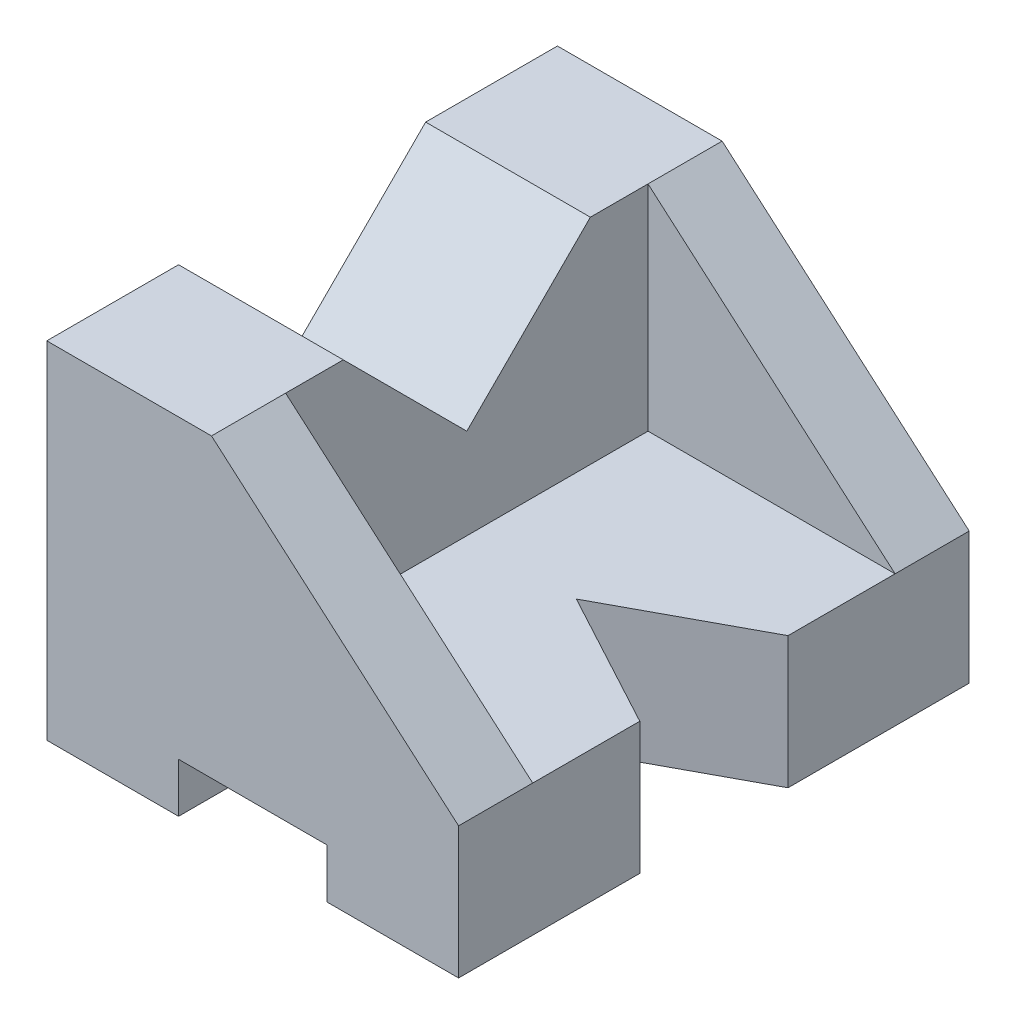
from build123d import *

# Parameters (mm, degrees)
BOSS_EXTRUDE1_DEPTH = 31
BOSS_EXTRUDE3_START = 22
BOSS_EXTRUDE3_DEPTH = 9
BOSS_EXTRUDE4_START = -22
BOSS_EXTRUDE4_DEPTH = 9
CUT_EXTRUDE1_REACH  = 62.208
CUT_EXTRUDE2_REACH  = 66.32


with BuildPart() as part:
    # Sketch1 → Boss-Extrude1 (new, symmetric)
    with BuildSketch(Plane.XY):
        Polygon((0, 42), (0, 0), (16, 0), (16, 6), (34, 6), (34, 0), (50, 0), (50, 16), (20, 16), (20, 42), align=None)
    extrude(amount=BOSS_EXTRUDE1_DEPTH, both=True)

    # Sketch1<7> → Boss-Extrude3 (add)
    with BuildSketch(Plane.XY.offset(BOSS_EXTRUDE3_START)):
        Polygon((50, 16), (20, 42), (20, 16), align=None)
    extrude(amount=BOSS_EXTRUDE3_DEPTH)

    # Sketch1<8> → Boss-Extrude4 (add)
    with BuildSketch(Plane.XY.offset(BOSS_EXTRUDE4_START)):
        Polygon((50, 16), (20, 42), (20, 16), align=None)
    extrude(amount=-BOSS_EXTRUDE4_DEPTH)

    # Sketch2 → Cut-Extrude1 (cut, up to next)
    with BuildSketch(Plane(origin=(20, 0, 0), x_dir=(0, 0, -1), z_dir=(1, 0, 0)), mode=Mode.PRIVATE) as cut_extrude1_sk1:
        Polygon((-15, 42), (0, 27), (15, 42), align=None)
    cut_extrude1_tool1 = extrude(cut_extrude1_sk1.sketch, amount=-CUT_EXTRUDE1_REACH, mode=Mode.PRIVATE) & part.part
    add(cut_extrude1_tool1.solids().sort_by_distance((20, 37, 0))[0], mode=Mode.SUBTRACT)

    # Sketch3 → Cut-Extrude2 (cut, up to next)
    with BuildSketch(Plane(origin=(0, 16, 0), x_dir=(1, 0, 0), z_dir=(0, 1, 0)), mode=Mode.PRIVATE) as cut_extrude2_sk1:
        Polygon((50, 9), (33.300468379, 0), (50, -9), align=None)
    cut_extrude2_tool1 = extrude(cut_extrude2_sk1.sketch, amount=-CUT_EXTRUDE2_REACH, mode=Mode.PRIVATE) & part.part
    add(cut_extrude2_tool1.solids().sort_by_distance((44.433489, 16, 0))[0], mode=Mode.SUBTRACT)


solid = part.part
